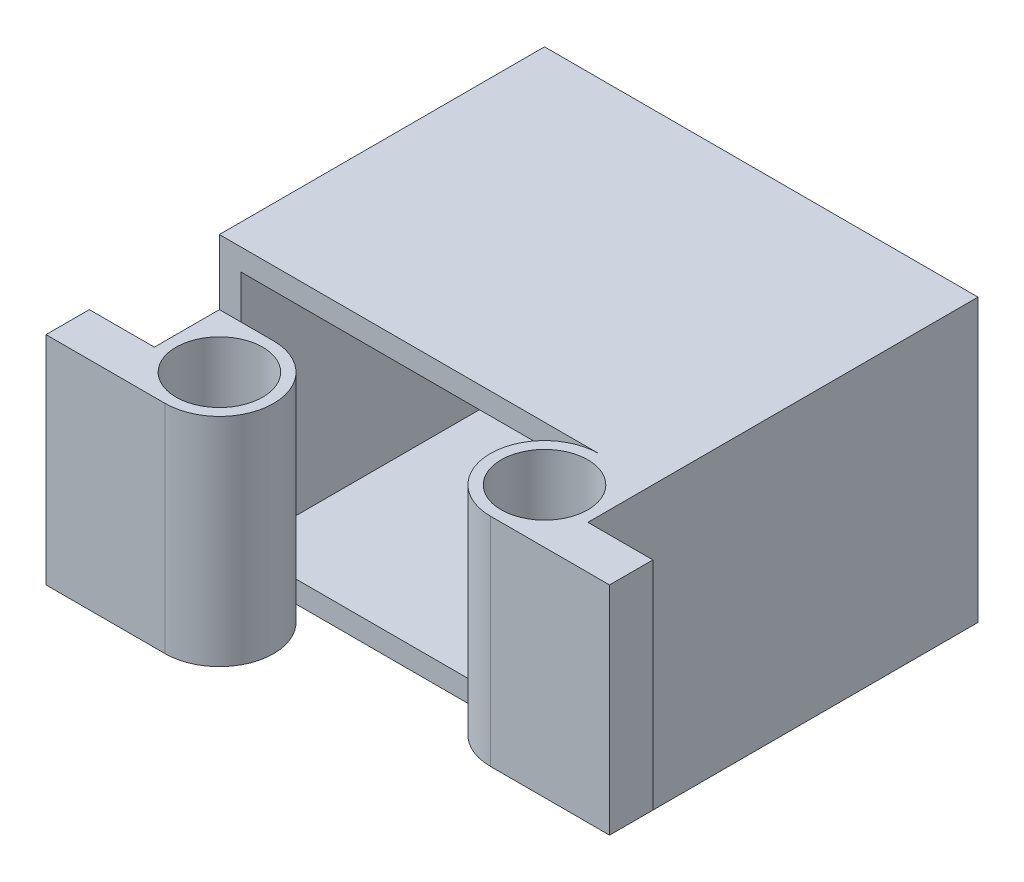
from build123d import *

# Parameters (mm, degrees)
SKETCH_1_W          = 20
SKETCH_1_H          = 13
EXTRUDE_1_DEPTH     = 15
SHELL_1_T           = -1
SKETCH_2_R          = 2.5
SKETCH_2_R_2        = 2
EXTRUDE_4_DEPTH     = 10
SKETCH_3_R          = 4.9
CUT_EXTRUDE_1_DEPTH = 0.2
SKETCH_9_R          = 2.5
SKETCH_9_R_2        = 2
EXTRUDE_8_DEPTH     = 10
SKETCH_6_W          = 2
SKETCH_6_H          = 10
EXTRUDE_10_DEPTH    = 3
SKETCH_10_W         = 2
SKETCH_10_H         = 10
EXTRUDE_11_DEPTH    = 3


with BuildPart() as part:
    # 스케치1 → 보스-돌출1 (new body)
    with BuildSketch(Plane.XY):
        Rectangle(SKETCH_1_W, SKETCH_1_H)
    extrude(amount=EXTRUDE_1_DEPTH)

    # 쉘1
    shell_1_openings = [part.faces().sort_by_distance(p)[0] for p in [
        (0, 0, 15),
    ]]
    offset(amount=SHELL_1_T, openings=shell_1_openings, kind=Kind.INTERSECTION)

    # 스케치3 → 컷-돌출1 (cut)
    with BuildSketch(Plane.XY.offset(1)):
        Circle(SKETCH_3_R)
    extrude(amount=-CUT_EXTRUDE_1_DEPTH, mode=Mode.SUBTRACT)

    # 스케치9 → 보스-돌출8 (add)
    # profile 1 of 3: a face of its own
    with BuildSketch(Plane(origin=(0, 6.5, 0), x_dir=(1, 0, 0), z_dir=(0, 1, 0))):
        with BuildLine():
            Line((10, -17.5), (10, -15))
            Line((10, -15), (7.5, -15))
            ThreePointArc((7.5, -15), (9.267766953, -15.732233047), (10, -17.5))
        make_face()
    # profile 2 of 3: a face of its own
    with BuildSketch(Plane(origin=(0, 6.5, 0), x_dir=(1, 0, 0), z_dir=(0, 1, 0))):
        with BuildLine():
            Line((10, -20), (10, -17.5))
            ThreePointArc((10, -17.5), (9.267766953, -19.267766953), (7.5, -20))
            Line((7.5, -20), (10, -20))
        make_face()
    # profile 3 of 3: a face of its own
    with BuildSketch(Plane(origin=(0, 6.5, 0), x_dir=(1, 0, 0), z_dir=(0, 1, 0))):
        with Locations((7.5, -17.5)):
            Circle(SKETCH_9_R)
        with Locations(Location((7.5, -17.5, 0), (0, 0, 270))):
            Circle(SKETCH_9_R_2, mode=Mode.SUBTRACT)
    extrude(amount=-EXTRUDE_8_DEPTH)


with BuildPart() as body_2:
    # 스케치2 → 보스-돌출4 (new body)
    # profile 1 of 3: a face of its own
    with BuildSketch(Plane(origin=(0, 3.5, 0), x_dir=(1, 0, 0), z_dir=(0, 1, 0))):
        with BuildLine():
            ThreePointArc((-7.5, -20), (-9.267766953, -19.267766953), (-10, -17.5))
            Line((-10, -17.5), (-10, -20))
            Line((-10, -20), (-7.5, -20))
        make_face()
    # profile 2 of 3: a face of its own
    with BuildSketch(Plane(origin=(0, 3.5, 0), x_dir=(1, 0, 0), z_dir=(0, 1, 0))):
        with Locations((-7.5, -17.5)):
            Circle(SKETCH_2_R)
        with Locations(Location((-7.5, -17.5, 0), (0, 0, 270))):
            Circle(SKETCH_2_R_2, mode=Mode.SUBTRACT)
    # profile 3 of 3: a face of its own
    with BuildSketch(Plane(origin=(0, 3.5, 0), x_dir=(1, 0, 0), z_dir=(0, 1, 0))):
        with BuildLine():
            Line((-7.5, -15), (-10, -15))
            Line((-10, -15), (-10, -17.5))
            ThreePointArc((-10, -17.5), (-9.267766953, -15.732233047), (-7.5, -15))
        make_face()
    extrude(amount=-EXTRUDE_4_DEPTH)


    add(part.part)  # 보스-돌출10 merges part
    # 스케치6 → 보스-돌출10 (add)
    with BuildSketch(Plane.ZY.offset(10)):
        with Locations((19, -1.5)):
            Rectangle(SKETCH_6_W, SKETCH_6_H)
    extrude(amount=EXTRUDE_10_DEPTH)

    # 스케치10 → 보스-돌출11 (add)
    with BuildSketch(Plane(origin=(10, 0, 0), x_dir=(0, 0, -1), z_dir=(1, 0, 0))):
        with Locations((-19, 1.5)):
            Rectangle(SKETCH_10_W, SKETCH_10_H)
    extrude(amount=EXTRUDE_11_DEPTH)


solid = body_2.part
